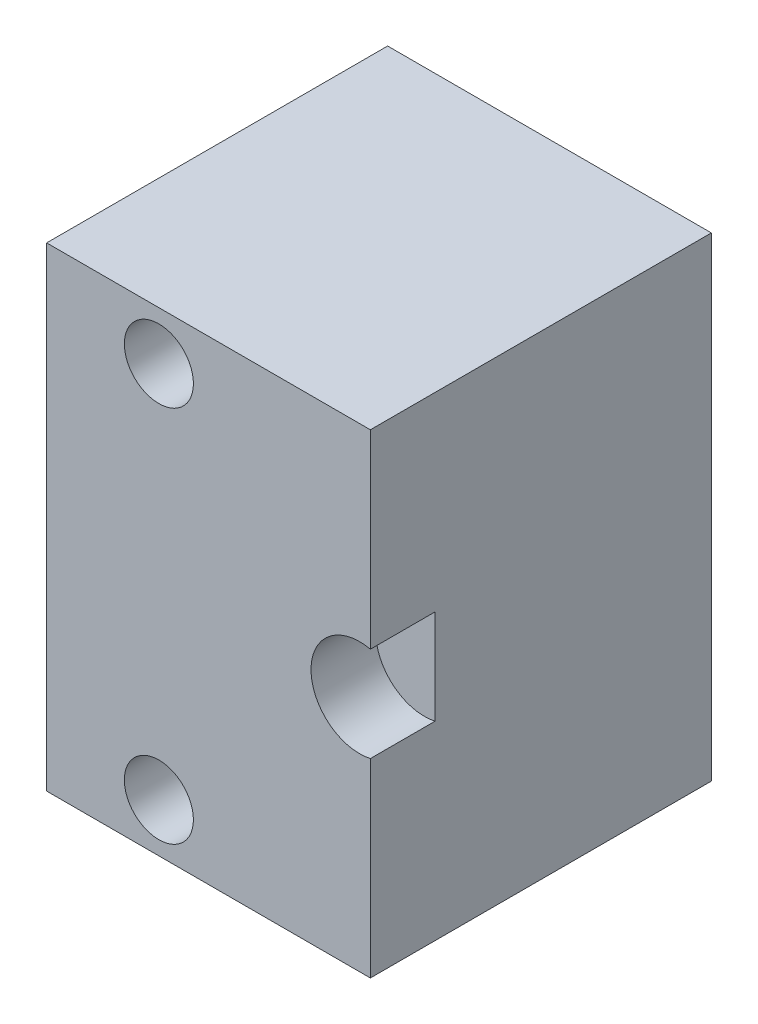
from build123d import *

# Parameters (mm, degrees)
SKETCH_1_W          = 15
SKETCH_1_H          = 22
SKETCH_1_R          = 1.6
EXTRUDE_1_DEPTH     = 15.8
SKETCH_2_R          = 2.25
CUT_EXTRUDE_1_DEPTH = 3


with BuildPart() as part:
    # Эскиз1 → Бобышка-Вытянуть1 (new body)
    with BuildSketch(Plane.XY):
        with Locations((7.5, 11)):
            Rectangle(SKETCH_1_W, SKETCH_1_H)
        with Locations((5.2, 19.75)):
            Circle(SKETCH_1_R, mode=Mode.SUBTRACT)
        with Locations((5.2, 2.25)):
            Circle(SKETCH_1_R, mode=Mode.SUBTRACT)
    extrude(amount=EXTRUDE_1_DEPTH)

    # Эскиз2 → Вырез-Вытянуть1 (cut)
    with BuildSketch(Plane.XY.offset(15.8)):
        with Locations((14.5, 11)):
            Circle(SKETCH_2_R)
    extrude(amount=-CUT_EXTRUDE_1_DEPTH, mode=Mode.SUBTRACT)


solid = part.part
